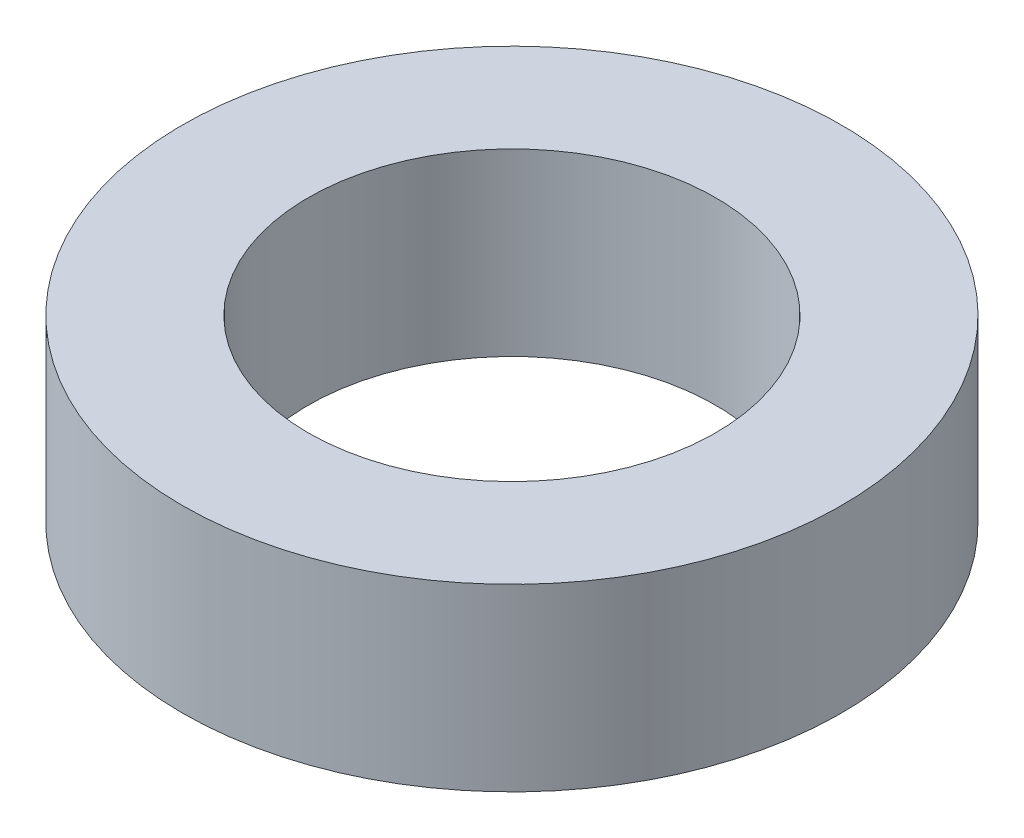
from build123d import *

# Parameters (mm, degrees)
SKETCH1_R           = 2.75
SKETCH1_R_2         = 1.7
BOSS_EXTRUDE1_DEPTH = 1.5


with BuildPart() as part:
    # Sketch1 → Boss-Extrude1 (new body)
    with BuildSketch(Plane(origin=(0, 0, 0), x_dir=(1, 0, 0), z_dir=(0, 1, 0))):
        with Locations(Location((0, 0, 0), (0, 0, 270))):
            Circle(SKETCH1_R)
        with Locations(Location((0, 0, 0), (0, 0, 270))):
            Circle(SKETCH1_R_2, mode=Mode.SUBTRACT)
    extrude(amount=BOSS_EXTRUDE1_DEPTH)


solid = part.part
